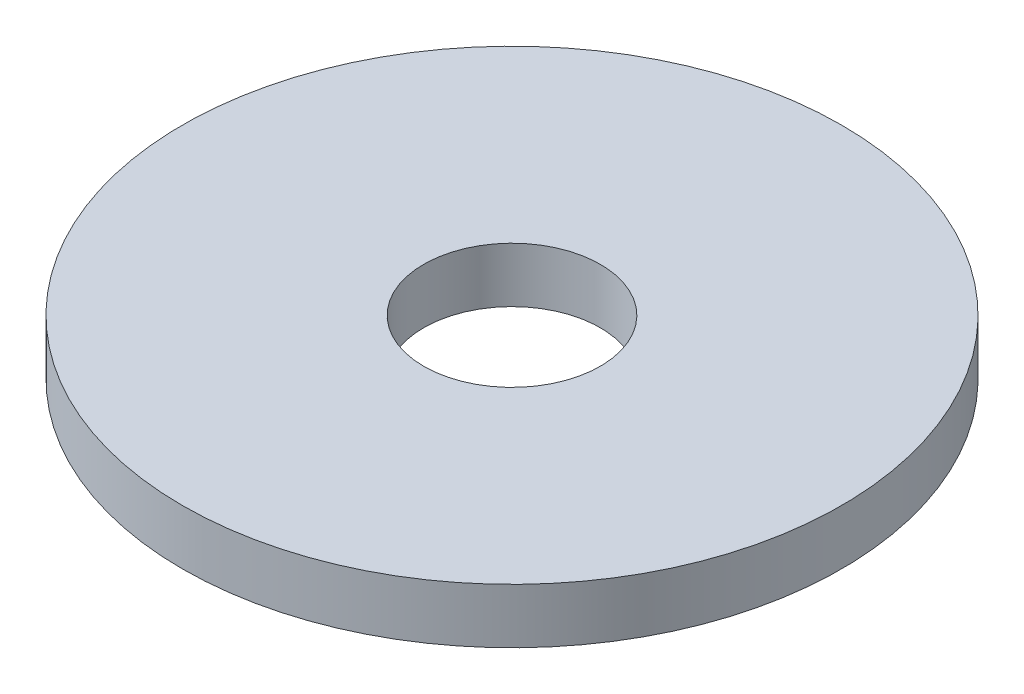
from build123d import *

# Parameters (mm, degrees)
SKETCH1_R           = 9.525
SKETCH1_R_2         = 2.5527
BOSS_EXTRUDE1_DEPTH = 1.5875


with BuildPart() as part:
    # Sketch1 → Boss-Extrude1 (new body)
    with BuildSketch(Plane(origin=(0, 0, 0), x_dir=(1, 0, 0), z_dir=(0, 1, 0))):
        with Locations(Location((0, 0, 0), (0, 0, 270))):
            Circle(SKETCH1_R)
        with Locations(Location((0, 0, 0), (0, 0, 270))):
            Circle(SKETCH1_R_2, mode=Mode.SUBTRACT)
    extrude(amount=BOSS_EXTRUDE1_DEPTH)


solid = part.part
